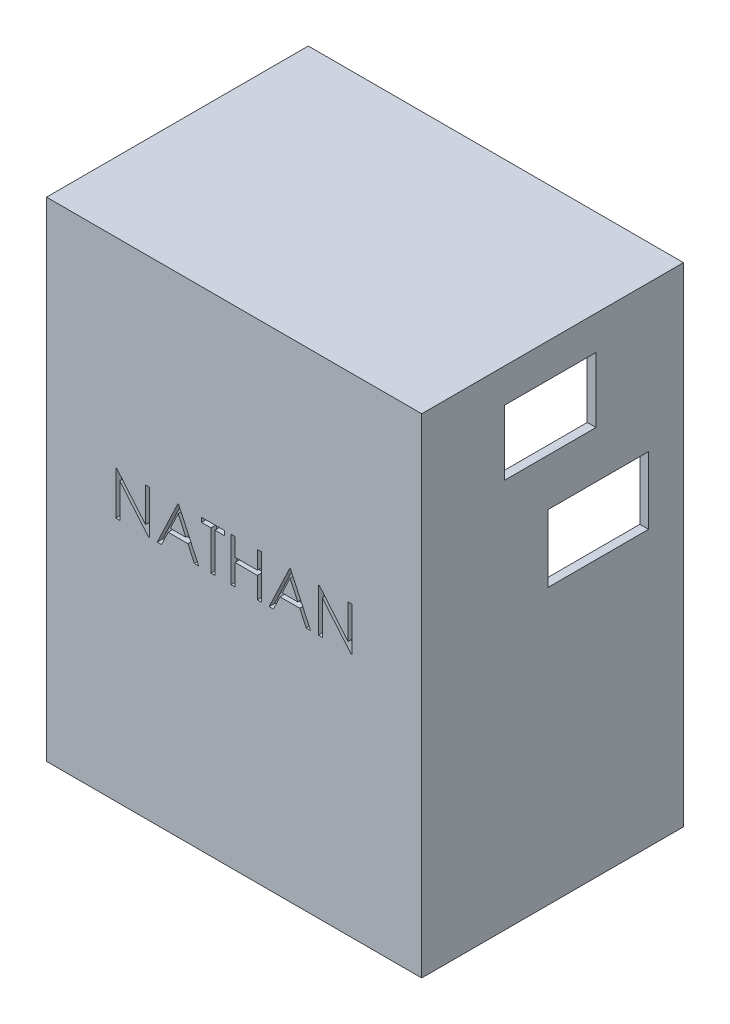
from build123d import *

# Parameters (mm, degrees)
ESQUISSE1_W                  = 86
ESQUISSE1_H                  = 94
BOSS_EXTRU_1_DEPTH           = 60
ESQUISSE2_W                  = 82
ESQUISSE2_H                  = 90
ENL_V_MAT_EXTRU_1_DEPTH      = 58
ESQUISSE3_W                  = 86
ESQUISSE3_H                  = 60
BOSS_EXTRU_2_DEPTH           = 18
ESQUISSE5_W                  = 82
ESQUISSE5_H                  = 56
ENL_V_MAT_EXTRU_2_DEPTH      = 18
ENL_V_MAT_EXTRU_3_DEPTH      = 154.427507312
ENL_V_MAT_EXTRU_3_DEPTH_BACK = 18
ESQUISSE7_W                  = 23
ESQUISSE7_H                  = 15.44
ESQUISSE8_W                  = 14.5
ESQUISSE8_H                  = 31
ENL_V_MAT_EXTRU_4_DEPTH      = 18
ESQUISSE11_W                 = 20.95
ESQUISSE11_H                 = 14.9
ENL_V_MAT_EXTRU_5_DEPTH      = 18
ESQUISSE12_R                 = 3.095
ENL_V_MAT_EXTRU_6_DEPTH      = 18
ESQUISSE15_R                 = 3
BOSS_EXTRU_3_DEPTH           = 18
ENL_V_MAT_EXTRU_7_DEPTH      = 1.3


with BuildPart() as part:
    # Esquisse1 → Boss.-Extru.1 (new body)
    with BuildSketch(Plane.XY):
        with Locations((43, 47)):
            Rectangle(ESQUISSE1_W, ESQUISSE1_H)
    extrude(amount=BOSS_EXTRU_1_DEPTH)

    # Esquisse2 → Enlèv. mat.-Extru.1 (cut)
    with BuildSketch(Plane.XY):
        with Locations((43, 47)):
            Rectangle(ESQUISSE2_W, ESQUISSE2_H)
    extrude(amount=ENL_V_MAT_EXTRU_1_DEPTH, mode=Mode.SUBTRACT)

    # Esquisse3 → Boss.-Extru.2 (add)
    with BuildSketch(Plane(origin=(0, 94, 0), x_dir=(1, 0, 0), z_dir=(0, 1, 0))):
        with Locations((43, -30)):
            Rectangle(ESQUISSE3_W, ESQUISSE3_H)
    extrude(amount=BOSS_EXTRU_2_DEPTH)

    # Esquisse5 → Enlèv. mat.-Extru.2 (cut)
    with BuildSketch(Plane(origin=(0, 92, 0), x_dir=(1, 0, 0), z_dir=(0, 1, 0))):
        with Locations((43, -30)):
            Rectangle(ESQUISSE5_W, ESQUISSE5_H)
    extrude(amount=ENL_V_MAT_EXTRU_2_DEPTH, mode=Mode.SUBTRACT)

    # Esquisse7 → Enlèv. mat.-Extru.3 (cut, two sides: drawn at the far end of the back side and taken through both)
    with BuildSketch(Plane(origin=(86, 0, 0), x_dir=(0, 0, -1), z_dir=(1, 0, 0)).offset(-ENL_V_MAT_EXTRU_3_DEPTH_BACK)):
        with Locations((-19.5, 70.77985545)):
            Rectangle(ESQUISSE7_W, ESQUISSE7_H)
    extrude(amount=ENL_V_MAT_EXTRU_3_DEPTH + ENL_V_MAT_EXTRU_3_DEPTH_BACK, mode=Mode.SUBTRACT)

    # Esquisse8 → Enlèv. mat.-Extru.4 (cut)
    with BuildSketch(Plane.ZY):
        with Locations((20.75, 63.5)):
            Rectangle(ESQUISSE8_W, ESQUISSE8_H)
    extrude(amount=-ENL_V_MAT_EXTRU_4_DEPTH, mode=Mode.SUBTRACT)

    # Esquisse11 → Enlèv. mat.-Extru.5 (cut)
    with BuildSketch(Plane(origin=(86, 0, 0), x_dir=(0, 0, -1), z_dir=(1, 0, 0))):
        with Locations((-30.534625058, 96.750653673)):
            Rectangle(ESQUISSE11_W, ESQUISSE11_H)
    extrude(amount=-ENL_V_MAT_EXTRU_5_DEPTH, mode=Mode.SUBTRACT)

    # Esquisse12 → Enlèv. mat.-Extru.6 (cut)
    with BuildSketch(Plane.XZ):
        with Locations(Location((36.461804468, 26.688728835, 0), (0, 0, 270))):
            Circle(ESQUISSE12_R)
    extrude(amount=-ENL_V_MAT_EXTRU_6_DEPTH, mode=Mode.SUBTRACT)

    # Esquisse15 → Boss.-Extru.3 (add)
    with BuildSketch(Plane(origin=(0, 0, 58), x_dir=(-1, 0, 0), z_dir=(0, 0, -1))):
        with Locations(Location((-77.525036721, 7.963761202, 0), (0, 0, 180))):
            Circle(ESQUISSE15_R)
        with Locations(Location((-8.474963279, 7.963761202, 0), (0, 0, 180))):
            Circle(ESQUISSE15_R)
        with Locations(Location((-77.525036721, 86.036238798, 0), (0, 0, 180))):
            Circle(ESQUISSE15_R)
        with Locations(Location((-8.474963279, 86.036238798, 0), (0, 0, 180))):
            Circle(ESQUISSE15_R)
    extrude(amount=BOSS_EXTRU_3_DEPTH)

    # Esquisse16 → Enlèv. mat.-Extru.7 (cut)
    # profile 1 of 6: a face of its own
    with BuildSketch(Plane.XY.offset(60)):
        Polygon((15.8952664, 56.22062268), (15.8952664, 66.22062268), (16.083567682, 66.22062268), (22.690138195, 58.350029732), (22.690138195, 66.22062268), (23.587574092, 66.22062268), (23.587574092, 56.22062268), (23.383247169, 56.22062268), (16.792702297, 64.073186783), (16.792702297, 56.22062268), align=None)
    # profile 2 of 6: a face of its own
    with BuildSketch(Plane.XY.offset(60)):
        Polygon((30.254240759, 66.22062268), (34.869625374, 56.22062268), (33.894064477, 56.22062268), (32.415699092, 59.425750886), (27.882445887, 59.425750886), (26.3640164, 56.22062268), (25.382445887, 56.22062268), (30.126035631, 66.22062268), align=None)
        Polygon((30.180122169, 64.269500886), (28.371227939, 60.451391911), (31.942942682, 60.451391911), align=None, mode=Mode.SUBTRACT)
    # profile 3 of 6: a face of its own
    with BuildSketch(Plane.XY.offset(60)):
        Polygon((35.510651015, 65.194981655), (35.510651015, 66.22062268), (40.767061272, 66.22062268), (40.767061272, 65.194981655), (38.587574092, 65.194981655), (38.587574092, 56.22062268), (37.690138195, 56.22062268), (37.690138195, 65.194981655), align=None)
    # profile 4 of 6: a face of its own
    with BuildSketch(Plane.XY.offset(60)):
        Polygon((42.30552281, 66.22062268), (43.202958708, 66.22062268), (43.202958708, 62.118058578), (48.331163836, 62.118058578), (48.331163836, 66.22062268), (49.228599733, 66.22062268), (49.228599733, 56.22062268), (48.331163836, 56.22062268), (48.331163836, 61.092417552), (43.202958708, 61.092417552), (43.202958708, 56.22062268), (42.30552281, 56.22062268), align=None)
    # profile 5 of 6: a face of its own
    with BuildSketch(Plane.XY.offset(60)):
        Polygon((55.8952664, 66.22062268), (60.510651015, 56.22062268), (59.535090118, 56.22062268), (58.056724733, 59.425750886), (53.523471528, 59.425750886), (52.005042041, 56.22062268), (51.023471528, 56.22062268), (55.767061272, 66.22062268), align=None)
        Polygon((55.82114781, 64.269500886), (54.01225358, 60.451391911), (57.583968323, 60.451391911), align=None, mode=Mode.SUBTRACT)
    # profile 6 of 6: a face of its own
    with BuildSketch(Plane.XY.offset(60)):
        Polygon((62.30552281, 56.22062268), (62.30552281, 66.22062268), (62.493824092, 66.22062268), (69.100394605, 58.350029732), (69.100394605, 66.22062268), (69.997830503, 66.22062268), (69.997830503, 56.22062268), (69.79350358, 56.22062268), (63.202958708, 64.073186783), (63.202958708, 56.22062268), align=None)
    extrude(amount=-ENL_V_MAT_EXTRU_7_DEPTH, mode=Mode.SUBTRACT)


solid = part.part
